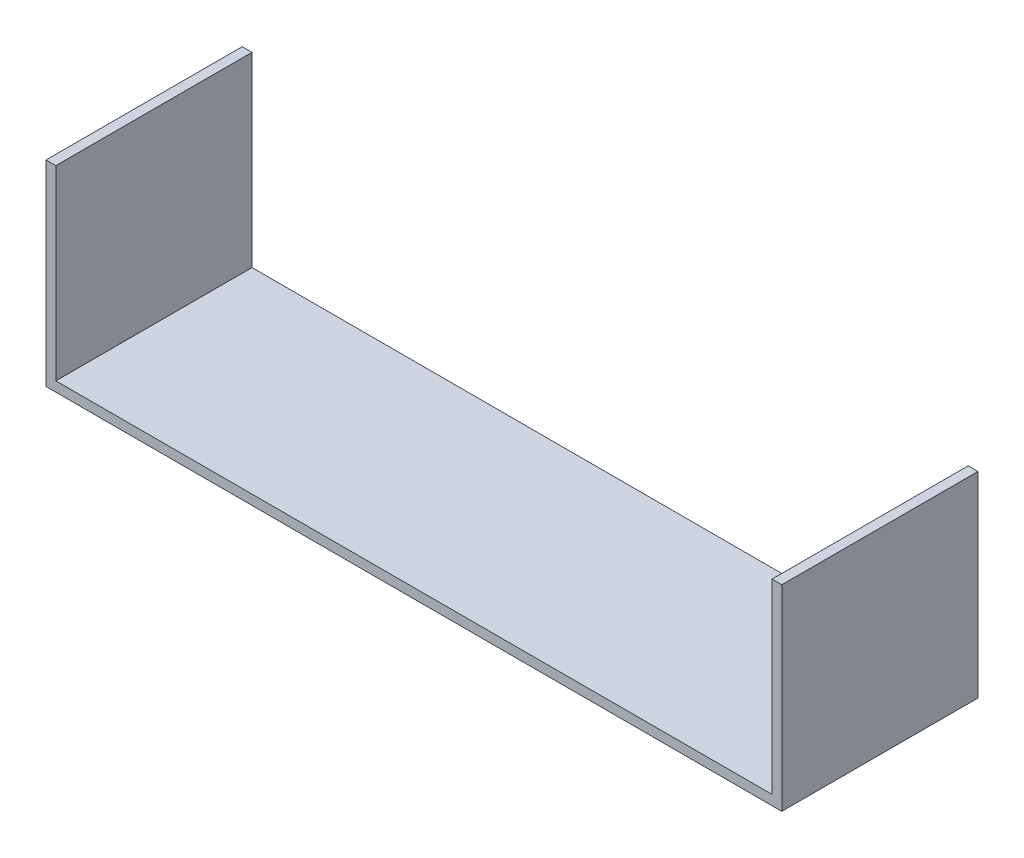
from build123d import *

# Parameters (mm, degrees)
BOSS_EXTRUDE1_DEPTH = 40


with BuildPart() as part:
    # Sketch1 → Boss-Extrude1 (new body)
    with BuildSketch(Plane.XY):
        Polygon((-75, 40), (-75, 0), (75, 0), (75, 40), (73, 40), (73, 2), (-73, 2), (-73, 40), align=None)
    extrude(amount=BOSS_EXTRUDE1_DEPTH)


solid = part.part
